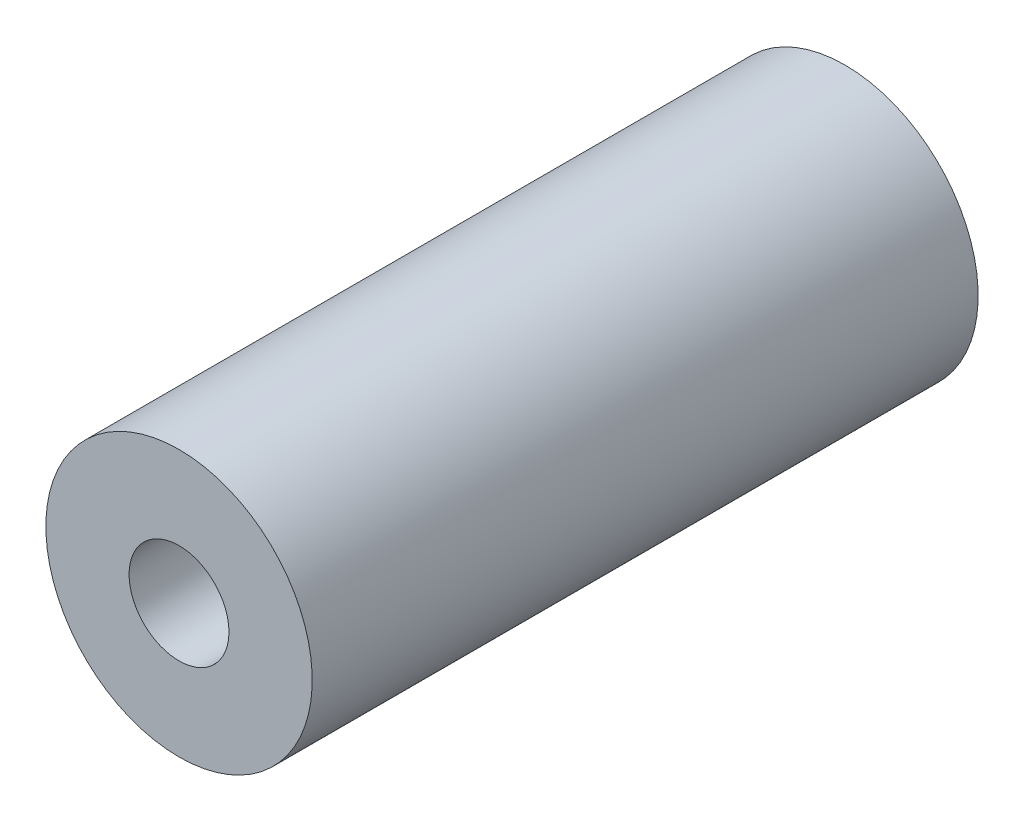
from build123d import *
from build123d.topology import SkipClean

# Parameters (mm, degrees)
ESQUISSE1_W             = 30
ESQUISSE1_H             = 6
ENL_V_MAT_EXTRU_4_DEPTH = 5
ENL_V_MAT_EXTRU_5_DEPTH = 18
ENL_V_MAT_EXTRU_6_DEPTH = 15


with BuildPart() as part:
    # Esquisse1 → Révolution1 (revolve)
    with BuildSketch(Plane(origin=(0, 0, 0), x_dir=(0, 0, -1), z_dir=(1, 0, 0)), mode=Mode.PRIVATE) as r_volution1_sk:
        with Locations((15, -3)):
            Rectangle(ESQUISSE1_W, ESQUISSE1_H)
    revolve(r_volution1_sk.sketch.rotate(Axis((0, 0, -30), (0, 0, 1)), 180), axis=Axis((0, 0, -30), (0, 0, 1)))

    # Esquisse2 → Enlèv. mat.-Extru.4 (cut)
    with BuildSketch(Plane.XY):
        with BuildLine():
            Line((-1.677050983, 1.5), (0, 1.5))
            Line((0, 1.5), (1.677050983, 1.5))
            ThreePointArc((1.677050983, 1.5), (0, 2.25), (-1.677050983, 1.5))
        make_face()
    extrude(amount=-ENL_V_MAT_EXTRU_4_DEPTH, mode=Mode.SUBTRACT)

    # Esquisse5 → Enlèv. mat.-Extru.5 (cut)
    with SkipClean():  # the faces are left unmerged after this step: merging them gives an invalid solid
        with BuildSketch(Plane.XY):
            with BuildLine():
                Line((-1.677050983, 1.5), (1.677050983, 1.5))
                ThreePointArc((1.677050983, 1.5), (0, -2.25), (-1.677050983, 1.5))
            make_face()
        extrude(amount=-ENL_V_MAT_EXTRU_5_DEPTH, mode=Mode.SUBTRACT)

    # Esquisse3 → Enlèv. mat.-Extru.6 (cut)
    with BuildSketch(Plane(origin=(0, 0, -30), x_dir=(-1, 0, 0), z_dir=(0, 0, -1))):
        with BuildLine():
            Line((3.620032518, 2.673081474), (-3.620032518, 2.673081474))
            ThreePointArc((-3.620032518, 2.673081474), (-1.407098729, -4.274350613), (4.5, 0))
            ThreePointArc((4.5, 0), (4.274350613, 1.407098729), (3.620032518, 2.673081474))
        make_face()
    extrude(amount=-ENL_V_MAT_EXTRU_6_DEPTH, mode=Mode.SUBTRACT)


solid = part.part
